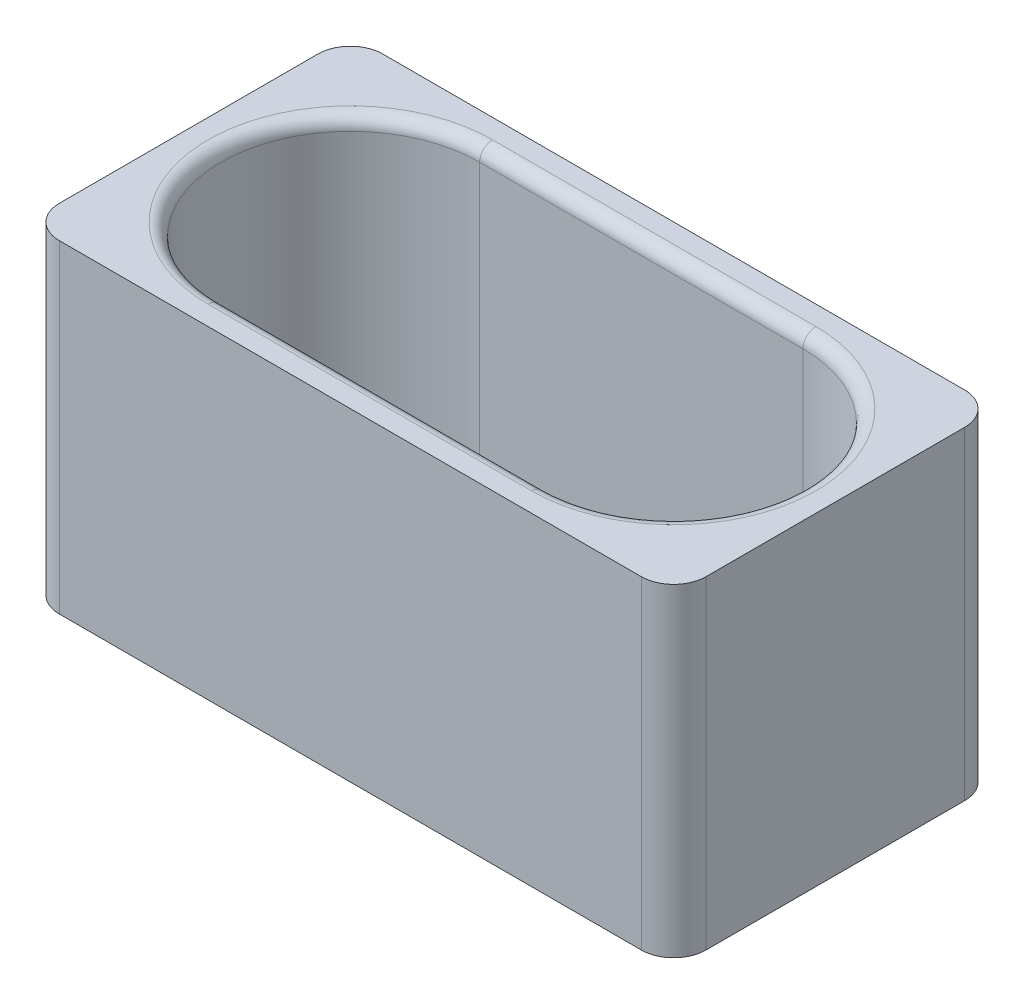
from build123d import *

# Parameters (mm, degrees)
SKETCH1_W           = 100
SKETCH1_H           = 50
BOSS_EXTRUDE1_DEPTH = 50
FILLET1_R           = 5
SKETCH2_R           = 2.5
BOSS_EXTRUDE2_DEPTH = 5
CHAMFER1_SIZE       = 1
CUT_EXTRUDE1_DEPTH  = 45
FILLET2_R           = 2


with BuildPart() as part:
    # Sketch1 → Boss-Extrude1 (new body)
    with BuildSketch(Plane(origin=(0, 0, 0), x_dir=(1, 0, 0), z_dir=(0, 1, 0))):
        Rectangle(SKETCH1_W, SKETCH1_H)
    extrude(amount=BOSS_EXTRUDE1_DEPTH)

    # Fillet1
    fillet1_edges = [part.edges().sort_by_distance(p)[0] for p in [
        (50, 25, 25),
        (-50, 25, 25),
        (-50, 25, -25),
        (50, 25, -25),
    ]]
    fillet(fillet1_edges, radius=FILLET1_R)

    # Sketch2 → Boss-Extrude2 (add)
    with BuildSketch(Plane.XZ):
        with Locations(Location((-25, 0, 0), (0, 0, 270))):
            Circle(SKETCH2_R)
        with Locations(Location((25, 0, 0), (0, 0, 270))):
            Circle(SKETCH2_R)
    extrude(amount=BOSS_EXTRUDE2_DEPTH)

    # Chamfer1
    chamfer1_edges = [part.edges().sort_by_distance(p)[0] for p in [
        (-25, -5, 2.5),
        (25, -5, 2.5),
    ]]
    chamfer(chamfer1_edges, length=CHAMFER1_SIZE)

    # Sketch3 → Cut-Extrude1 (cut)
    with BuildSketch(Plane(origin=(0, 50, 0), x_dir=(1, 0, 0), z_dir=(0, 1, 0))):
        with BuildLine():
            Line((-25, 20), (25, 20))
            ThreePointArc((25, 20), (45, 0), (25, -20))
            Line((25, -20), (-25, -20))
            ThreePointArc((-25, -20), (-45, 0), (-25, 20))
        make_face()
    extrude(amount=-CUT_EXTRUDE1_DEPTH, mode=Mode.SUBTRACT)

    # Fillet2
    fillet2_edges = [part.edges().sort_by_distance(p)[0] for p in [
        (-45, 50, 0),
        (0, 50, 20),
        (45, 50, 0),
        (0, 50, -20),
        (0, 5, 20),
        (45, 5, 0),
        (0, 5, -20),
        (-45, 5, 0),
    ]]
    fillet(fillet2_edges, radius=FILLET2_R)


solid = part.part
